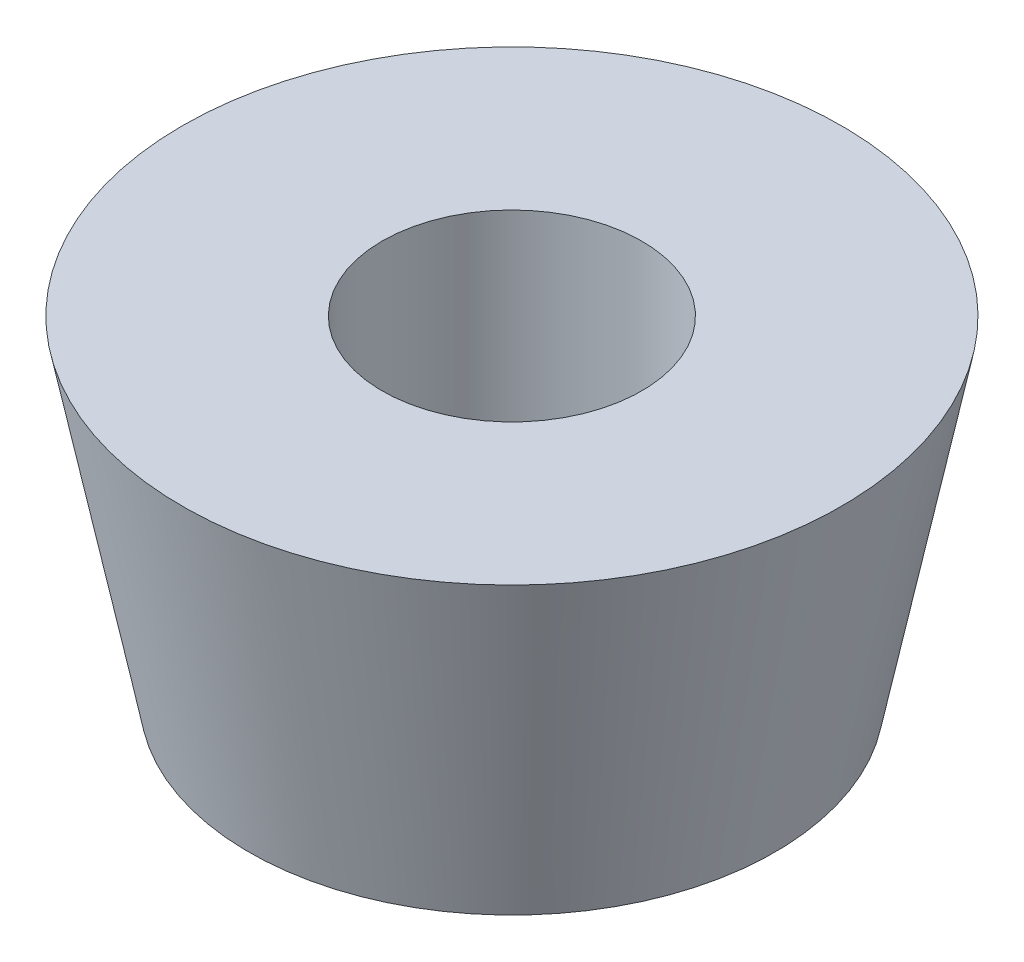
from build123d import *


with BuildPart() as part:
    # Sketch1 → Revolve1 (revolve)
    with BuildSketch(Plane.XY, mode=Mode.PRIVATE) as revolve1_sk:
        Polygon((1.95, 0), (1.95, -5), (3.95, -5), (4.95, 0), align=None)
    revolve(revolve1_sk.sketch.rotate(Axis((0, 0, 0), (0, -1, 0)), 180), axis=Axis((0, 0, 0), (0, -1, 0)))


solid = part.part
